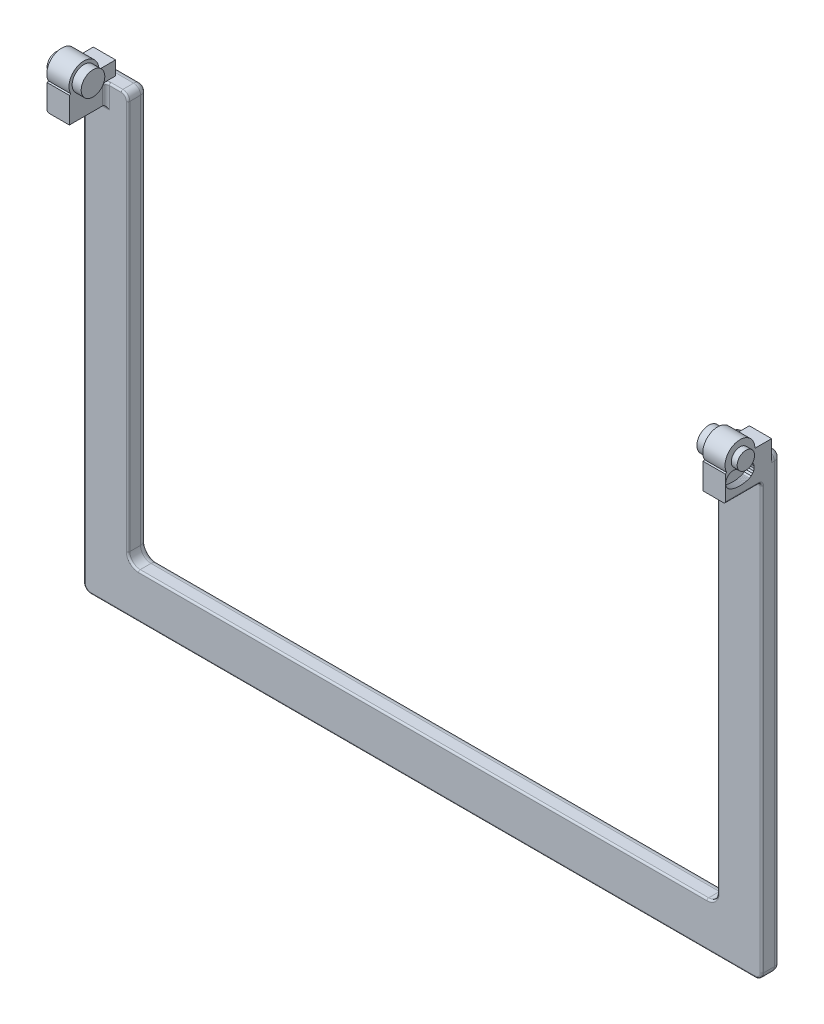
from build123d import *

# Parameters (mm, degrees)
LEFT_LEG_START                = -18.1
LEFT_LEG_DEPTH                = 5.6
FOOT_CROSSBAR_START           = -18.1
FOOT_CROSSBAR_DEPTH           = 5.6
RIGHT_LEG_START               = -18.1
RIGHT_LEG_DEPTH               = 5.6
PIVOT_NECK_0_START            = -2.6
PIVOT_NECK_0_DEPTH            = 6.4
PIVOT_LUG_0_START             = -2.6
SKETCH_5_R                    = 4.3
PIVOT_LUG_0_DEPTH             = 6.4
GLASS_KEEPER_0_START          = 3.6
GLASS_KEEPER_0_PROFILE_R      = 3.4
GLASS_KEEPER_0_DEPTH          = 2.8
CAPTIVE_AXLE_0_START          = -4.3
SKETCH_7_R                    = 2.5
CAPTIVE_AXLE_0_DEPTH          = 2
BLIND_ROTATION_GROOVE_0_START = -2.7
BLIND_ROTATION_GROOVE_0_DEPTH = 2.1
PIVOT_NECK_1_START            = 186.2
PIVOT_NECK_1_DEPTH            = 6.4
PIVOT_LUG_1_START             = 186.2
SKETCH_10_R                   = 4.3
PIVOT_LUG_1_DEPTH             = 6.4
GLASS_KEEPER_1_START          = 183.6
GLASS_KEEPER_1_PROFILE_R      = 3.4
GLASS_KEEPER_1_DEPTH          = 2.8
CAPTIVE_AXLE_1_START          = 192.3
SKETCH_12_R                   = 2.5
CAPTIVE_AXLE_1_DEPTH          = 2
BLIND_ROTATION_GROOVE_1_START = 190.6
BLIND_ROTATION_GROOVE_1_DEPTH = 2.1
STAND_LEG_ROOT_ROUND_R        = 3
PIVOT_NECK_ROOT_ROUND_R       = 1
STAND_CONTACT_ROUND_R         = 2
STAND_FRONT_EDGE_ROUND_R      = 0.5


with BuildPart() as part:
    # Left_leg_profile → Left_leg (new body)
    with BuildSketch(Plane.XY.offset(LEFT_LEG_START)):
        with BuildLine():
            Line((-0.6, -6.6), (8.2, -6.6))
            ThreePointArc((8.2, -6.6), (9.614213562, -6.014213562), (10.2, -4.6))
            Line((10.2, -4.6), (10.2, 119))
            ThreePointArc((10.2, 119), (9.614213562, 120.414213562), (8.2, 121))
            Line((8.2, 121), (-0.6, 121))
            ThreePointArc((-0.6, 121), (-2.014213562, 120.414213562), (-2.6, 119))
            Line((-2.6, 119), (-2.6, -4.6))
            ThreePointArc((-2.6, -4.6), (-2.014213562, -6.014213562), (-0.6, -6.6))
        make_face()
    extrude(amount=LEFT_LEG_DEPTH)

    # Эскиз2 → Foot_crossbar (add)
    with BuildSketch(Plane.XY.offset(FOOT_CROSSBAR_START)):
        with BuildLine():
            Line((-0.6, -9), (190.6, -9))
            ThreePointArc((190.6, -9), (192.014213562, -8.414213562), (192.6, -7))
            Line((192.6, -7), (192.6, 1.8))
            ThreePointArc((192.6, 1.8), (192.014213562, 3.214213562), (190.6, 3.8))
            Line((190.6, 3.8), (-0.6, 3.8))
            ThreePointArc((-0.6, 3.8), (-2.014213562, 3.214213562), (-2.6, 1.8))
            Line((-2.6, 1.8), (-2.6, -7))
            ThreePointArc((-2.6, -7), (-2.014213562, -8.414213562), (-0.6, -9))
        make_face()
    extrude(amount=FOOT_CROSSBAR_DEPTH)

    # Эскиз3 → Right_leg (add)
    with BuildSketch(Plane.XY.offset(RIGHT_LEG_START)):
        with BuildLine():
            Line((181.8, -6.6), (190.6, -6.6))
            ThreePointArc((190.6, -6.6), (192.014213562, -6.014213562), (192.6, -4.6))
            Line((192.6, -4.6), (192.6, 119))
            ThreePointArc((192.6, 119), (192.014213562, 120.414213562), (190.6, 121))
            Line((190.6, 121), (181.8, 121))
            ThreePointArc((181.8, 121), (180.385786438, 120.414213562), (179.8, 119))
            Line((179.8, 119), (179.8, -4.6))
            ThreePointArc((179.8, -4.6), (180.385786438, -6.014213562), (181.8, -6.6))
        make_face()
    extrude(amount=RIGHT_LEG_DEPTH)

    # Эскиз4 → Pivot_neck_0 (add)
    with BuildSketch(Plane(origin=(0, 0, 0), x_dir=(0, 0, -1), z_dir=(1, 0, 0)).offset(PIVOT_NECK_0_START)):
        Polygon((15.3, 115.4), (15.3, 125), (6.2, 125), (2, 122.8), (2, 115.4), align=None)
    extrude(amount=PIVOT_NECK_0_DEPTH)

    # Эскиз5 → Pivot_lug_0 (add)
    with BuildSketch(Plane(origin=(0, 0, 0), x_dir=(0, 0, -1), z_dir=(1, 0, 0)).offset(PIVOT_LUG_0_START)):
        with Locations((6.2, 125)):
            Circle(SKETCH_5_R)
    extrude(amount=PIVOT_LUG_0_DEPTH)

    # Glass_keeper_0_profile → Glass_keeper_0 (add)
    with BuildSketch(Plane(origin=(0, 0, 0), x_dir=(0, 0, -1), z_dir=(1, 0, 0)).offset(GLASS_KEEPER_0_START)):
        with Locations((6.2, 125)):
            Circle(GLASS_KEEPER_0_PROFILE_R)
    extrude(amount=GLASS_KEEPER_0_DEPTH)

    # Эскиз7 → Captive_axle_0 (add)
    with BuildSketch(Plane(origin=(0, 0, 0), x_dir=(0, 0, -1), z_dir=(1, 0, 0)).offset(CAPTIVE_AXLE_0_START)):
        with Locations((6.2, 125)):
            Circle(SKETCH_7_R)
    extrude(amount=CAPTIVE_AXLE_0_DEPTH)

    # Эскиз8 → Blind_rotation_groove_0 (cut)
    with BuildSketch(Plane(origin=(0, 0, 0), x_dir=(0, 0, -1), z_dir=(1, 0, 0)).offset(BLIND_ROTATION_GROOVE_0_START)):
        Polygon((8.955320713, 118.348067366), (8.736200345, 118.261477327), (8.51436415, 118.182103068), (8.290049676, 118.110029583), (8.063497125, 118.045334051), (7.834949094, 117.988085749), (7.604650319, 117.938345981), (7.372847408, 117.896168009), (7.139788584, 117.861596998), (6.90572341, 117.834669968), (6.67090253, 117.815415753), (6.435577396, 117.80385497), (6.2, 117.8), (5.964422604, 117.80385497), (5.72909747, 117.815415753), (5.49427659, 117.834669968), (5.260211416, 117.861596998), (5.027152592, 117.896168009), (4.795349681, 117.938345981), (4.565050906, 117.988085749), (4.336502875, 118.045334051), (4.109950324, 118.110029583), (3.88563585, 118.182103068), (3.663799655, 118.261477327), (3.444679287, 118.348067366), (2.947307694, 118.635224989), (2.54120549, 119.041327194), (2.254047867, 119.538698786), (2.105404143, 120.093444715), (2.105404143, 120.66775996), (2.254047867, 121.222505889), (2.54120549, 121.719877481), (2.947307694, 122.125979686), (3.444679287, 122.413137309), (3.999425215, 122.561781032), (4.573740461, 122.561781032), (5.128486389, 122.413137309), (5.213699866, 122.379463405), (5.299969497, 122.348595637), (5.387202904, 122.32056706), (5.475306674, 122.295407686), (5.564186464, 122.273144458), (5.653747098, 122.253801215), (5.743892674, 122.23739867), (5.834526662, 122.223954388), (5.925552007, 122.213482765), (6.016871238, 122.205995015), (6.108386568, 122.201499155), (6.2, 122.2), (6.291613432, 122.201499155), (6.383128762, 122.205995015), (6.474447993, 122.213482765), (6.565473338, 122.223954388), (6.656107326, 122.23739867), (6.746252902, 122.253801215), (6.835813536, 122.273144458), (6.924693326, 122.295407686), (7.012797096, 122.32056706), (7.100030503, 122.348595637), (7.186300134, 122.379463405), (7.271513611, 122.413137309), (7.826259539, 122.561781032), (8.400574785, 122.561781032), (8.955320713, 122.413137309), (9.452692306, 122.125979686), (9.85879451, 121.719877481), (10.145952133, 121.222505889), (10.294595857, 120.66775996), (10.294595857, 120.093444715), (10.145952133, 119.538698786), (9.85879451, 119.041327194), (9.452692306, 118.635224989), align=None)
    extrude(amount=BLIND_ROTATION_GROOVE_0_DEPTH, mode=Mode.SUBTRACT)

    # Эскиз9 → Pivot_neck_1 (add)
    with BuildSketch(Plane(origin=(0, 0, 0), x_dir=(0, 0, -1), z_dir=(1, 0, 0)).offset(PIVOT_NECK_1_START)):
        Polygon((15.3, 115.4), (15.3, 125), (6.2, 125), (2, 122.8), (2, 115.4), align=None)
    extrude(amount=PIVOT_NECK_1_DEPTH)

    # Эскиз10 → Pivot_lug_1 (add)
    with BuildSketch(Plane(origin=(0, 0, 0), x_dir=(0, 0, -1), z_dir=(1, 0, 0)).offset(PIVOT_LUG_1_START)):
        with Locations((6.2, 125)):
            Circle(SKETCH_10_R)
    extrude(amount=PIVOT_LUG_1_DEPTH)

    # Glass_keeper_1_profile → Glass_keeper_1 (add)
    with BuildSketch(Plane(origin=(0, 0, 0), x_dir=(0, 0, -1), z_dir=(1, 0, 0)).offset(GLASS_KEEPER_1_START)):
        with Locations((6.2, 125)):
            Circle(GLASS_KEEPER_1_PROFILE_R)
    extrude(amount=GLASS_KEEPER_1_DEPTH)

    # Эскиз12 → Captive_axle_1 (add)
    with BuildSketch(Plane(origin=(0, 0, 0), x_dir=(0, 0, -1), z_dir=(1, 0, 0)).offset(CAPTIVE_AXLE_1_START)):
        with Locations((6.2, 125)):
            Circle(SKETCH_12_R)
    extrude(amount=CAPTIVE_AXLE_1_DEPTH)

    # Эскиз13 → Blind_rotation_groove_1 (cut)
    with BuildSketch(Plane(origin=(0, 0, 0), x_dir=(0, 0, -1), z_dir=(1, 0, 0)).offset(BLIND_ROTATION_GROOVE_1_START)):
        Polygon((8.955320713, 118.348067366), (8.736200345, 118.261477327), (8.51436415, 118.182103068), (8.290049676, 118.110029583), (8.063497125, 118.045334051), (7.834949094, 117.988085749), (7.604650319, 117.938345981), (7.372847408, 117.896168009), (7.139788584, 117.861596998), (6.90572341, 117.834669968), (6.67090253, 117.815415753), (6.435577396, 117.80385497), (6.2, 117.8), (5.964422604, 117.80385497), (5.72909747, 117.815415753), (5.49427659, 117.834669968), (5.260211416, 117.861596998), (5.027152592, 117.896168009), (4.795349681, 117.938345981), (4.565050906, 117.988085749), (4.336502875, 118.045334051), (4.109950324, 118.110029583), (3.88563585, 118.182103068), (3.663799655, 118.261477327), (3.444679287, 118.348067366), (2.947307694, 118.635224989), (2.54120549, 119.041327194), (2.254047867, 119.538698786), (2.105404143, 120.093444715), (2.105404143, 120.66775996), (2.254047867, 121.222505889), (2.54120549, 121.719877481), (2.947307694, 122.125979686), (3.444679287, 122.413137309), (3.999425215, 122.561781032), (4.573740461, 122.561781032), (5.128486389, 122.413137309), (5.213699866, 122.379463405), (5.299969497, 122.348595637), (5.387202904, 122.32056706), (5.475306674, 122.295407686), (5.564186464, 122.273144458), (5.653747098, 122.253801215), (5.743892674, 122.23739867), (5.834526662, 122.223954388), (5.925552007, 122.213482765), (6.016871238, 122.205995015), (6.108386568, 122.201499155), (6.2, 122.2), (6.291613432, 122.201499155), (6.383128762, 122.205995015), (6.474447993, 122.213482765), (6.565473338, 122.223954388), (6.656107326, 122.23739867), (6.746252902, 122.253801215), (6.835813536, 122.273144458), (6.924693326, 122.295407686), (7.012797096, 122.32056706), (7.100030503, 122.348595637), (7.186300134, 122.379463405), (7.271513611, 122.413137309), (7.826259539, 122.561781032), (8.400574785, 122.561781032), (8.955320713, 122.413137309), (9.452692306, 122.125979686), (9.85879451, 121.719877481), (10.145952133, 121.222505889), (10.294595857, 120.66775996), (10.294595857, 120.093444715), (10.145952133, 119.538698786), (9.85879451, 119.041327194), (9.452692306, 118.635224989), align=None)
    extrude(amount=BLIND_ROTATION_GROOVE_1_DEPTH, mode=Mode.SUBTRACT)

    # Stand_leg_root_round
    stand_leg_root_round_edges = [part.edges().sort_by_distance(p)[0] for p in [
        (10.2, 3.8, -15.3),
        (179.8, 3.8, -15.3),
    ]]
    fillet(stand_leg_root_round_edges, radius=STAND_LEG_ROOT_ROUND_R)

    # Pivot_neck_root_round
    pivot_neck_root_round_edges = [part.edges().sort_by_distance(p)[0] for p in [
        (189.4, 115.4, -12.5),
        (186.2, 118.2, -12.5),
        (3.8, 118.2, -12.5),
        (0.6, 115.4, -12.5),
    ]]
    fillet(pivot_neck_root_round_edges, radius=PIVOT_NECK_ROOT_ROUND_R)

    # Stand_contact_round
    stand_contact_round_edges = [part.edges().sort_by_distance(p)[0] for p in [
        (-2.014213562, -8.414213562, -18.1),
        (95, -9, -18.1),
        (192.014213562, -8.414213562, -18.1),
        (192.6, 56, -18.1),
        (179.8, 62.9, -18.1),
        (192.014213562, 120.414213562, -18.1),
        (186.2, 121, -18.1),
        (180.385786438, 120.414213562, -18.1),
        (95, 3.8, -18.1),
        (10.2, 62.9, -18.1),
        (11.078679656, 4.678679656, -18.1),
        (178.921320344, 4.678679656, -18.1),
        (-2.6, 56, -18.1),
        (-2.014213562, 120.414213562, -18.1),
        (3.8, 121, -18.1),
        (9.614213562, 120.414213562, -18.1),
    ]]
    fillet(stand_contact_round_edges, radius=STAND_CONTACT_ROUND_R)

    # Stand_front_edge_round
    stand_front_edge_round_edges = [part.edges().sort_by_distance(p)[0] for p in [
        (183.5, 121, -12.5),
        (185.907106781, 121, -12.207106781),
        (180.385786438, 120.414213562, -12.5),
        (6.5, 121, -12.5),
        (9.614213562, 120.414213562, -12.5),
        (10.2, 62.9, -12.5),
        (-2.6, 53.7, -12.5),
        (11.078679656, 4.678679656, -12.5),
        (-2.014213562, -8.414213562, -12.5),
        (95, 3.8, -12.5),
        (95, -9, -12.5),
        (178.921320344, 4.678679656, -12.5),
        (192.014213562, -8.414213562, -12.5),
        (179.8, 62.9, -12.5),
        (192.6, 53.7, -12.5),
        (4.092893219, 121, -12.207106781),
        (-2.6, 115.107106781, -12.207106781),
        (-2.6, 115.4, -6.75),
        (192.6, 115.107106781, -12.207106781),
        (192.6, 115.4, -6.75),
    ]]
    fillet(stand_front_edge_round_edges, radius=STAND_FRONT_EDGE_ROUND_R)


solid = part.part
